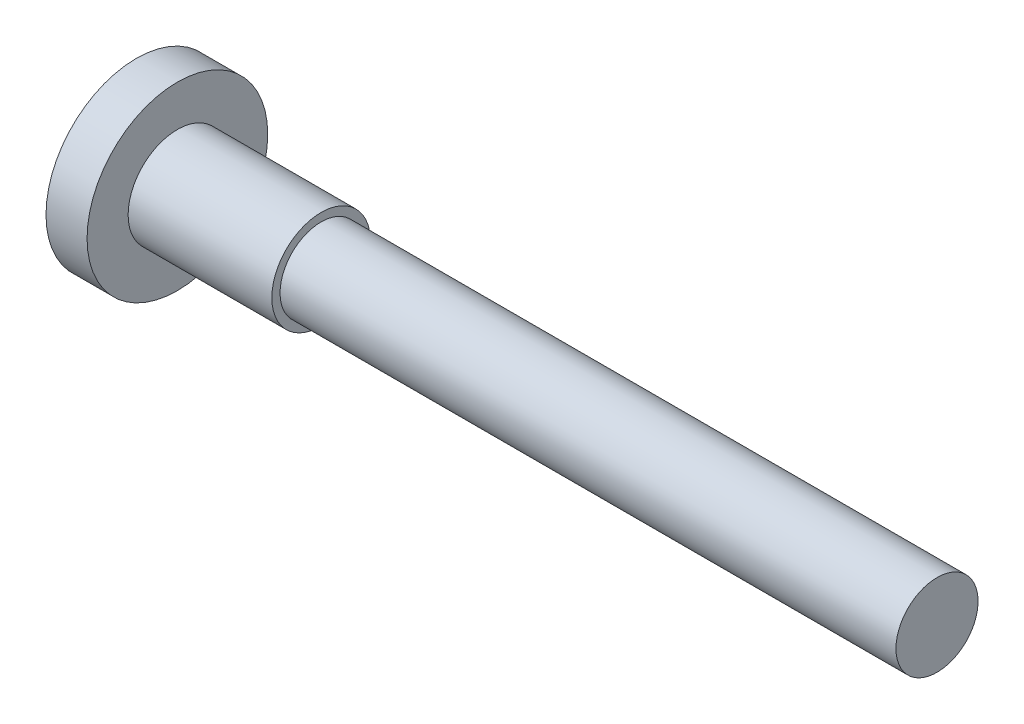
from build123d import *


with BuildPart() as part:
    # 草图1 → 旋转1 (revolve)
    with BuildSketch(Plane(origin=(0, 0, 0), x_dir=(1, 0, 0), z_dir=(0, 1, 0)), mode=Mode.PRIVATE) as revolve_1_sk:
        Polygon((0, 0), (0, 11), (5, 11), (5, 6), (22.5, 6), (22.5, 5), (97.5, 5), (97.5, 0), align=None)
    revolve(revolve_1_sk.sketch.rotate(Axis((-49.641307882, 0, 0), (1, 0, 0)), 180), axis=Axis((-49.641307882, 0, 0), (1, 0, 0)))


solid = part.part
